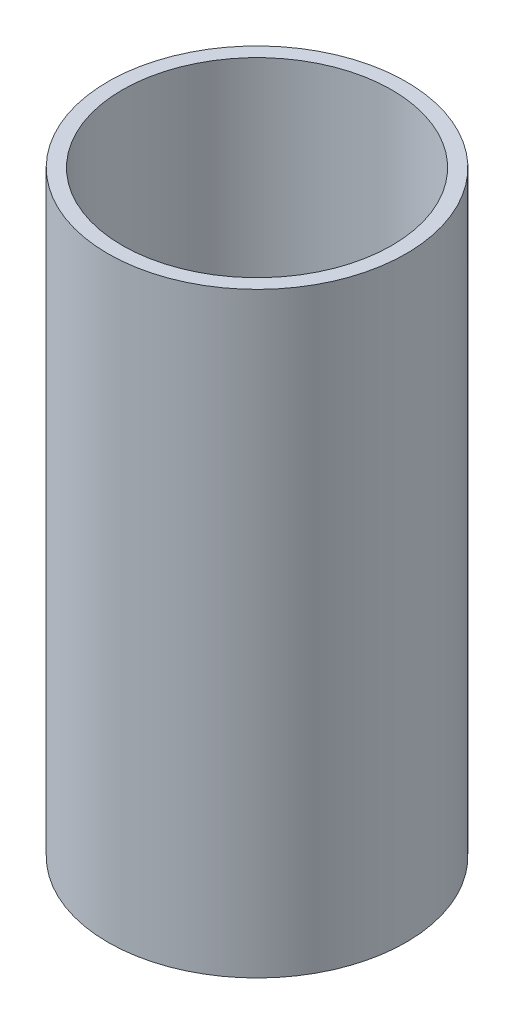
from build123d import *

# Parameters (mm, degrees)
SKETCH1_R           = 25
SKETCH1_R_2         = 22.6
BOSS_EXTRUDE1_DEPTH = 100


with BuildPart() as part:
    # Sketch1 → Boss-Extrude1 (new body)
    with BuildSketch(Plane(origin=(0, 0, 0), x_dir=(1, 0, 0), z_dir=(0, 1, 0))):
        with Locations(Location((0, 0, 0), (0, 0, 270))):
            Circle(SKETCH1_R)
        with Locations(Location((0, 0, 0), (0, 0, 270))):
            Circle(SKETCH1_R_2, mode=Mode.SUBTRACT)
    extrude(amount=BOSS_EXTRUDE1_DEPTH)


solid = part.part
